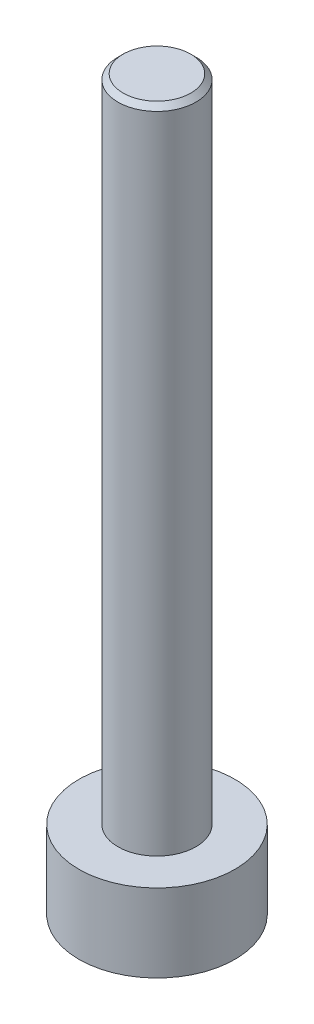
from build123d import *

# Parameters (mm, degrees)
SKETCH1_R           = 3
BOSS_EXTRUDE1_DEPTH = 3
SKETCH2_R           = 1.5
BOSS_EXTRUDE2_DEPTH = 25
CHAMFER1_SIZE       = 0.2
CUT_EXTRUDE1_DEPTH  = 2


with BuildPart() as part:
    # Sketch1 → Boss-Extrude1 (new body)
    with BuildSketch(Plane(origin=(0, 0, 0), x_dir=(1, 0, 0), z_dir=(0, 1, 0))):
        with Locations(Location((0, 0, 0), (0, 0, 270))):
            Circle(SKETCH1_R)
    extrude(amount=BOSS_EXTRUDE1_DEPTH)

    # Sketch2 → Boss-Extrude2 (add)
    with BuildSketch(Plane(origin=(0, 3, 0), x_dir=(1, 0, 0), z_dir=(0, 1, 0))):
        with Locations(Location((0, 0, 0), (0, 0, 270))):
            Circle(SKETCH2_R)
    extrude(amount=BOSS_EXTRUDE2_DEPTH)

    # Chamfer1
    chamfer1_edges = [part.edges().sort_by_distance(p)[0] for p in [
        (0, 28, -1.5),
    ]]
    chamfer(chamfer1_edges, length=CHAMFER1_SIZE)

    # Sketch3 → Cut-Extrude1 (cut)
    with BuildSketch(Plane.XZ):
        Polygon((0, 1.529103694), (-1.324242644, 0.764551847), (-1.324242644, -0.764551847), (0, -1.529103694), (1.324242644, -0.764551847), (1.324242644, 0.764551847), align=None)
    extrude(amount=-CUT_EXTRUDE1_DEPTH, mode=Mode.SUBTRACT)


solid = part.part
